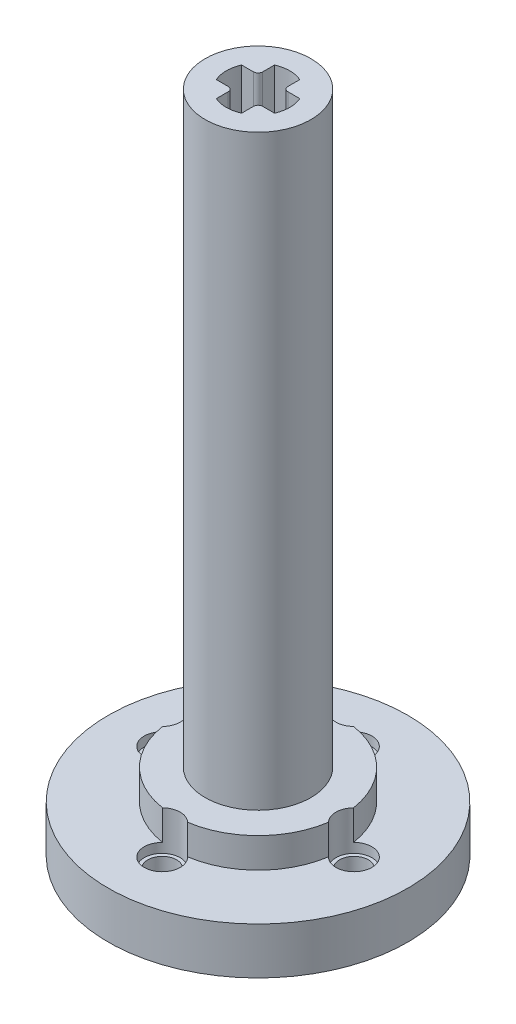
from build123d import *

# Parameters (mm, degrees)
CUT_EXTRUDE1_REACH             = 60.152
SKETCH3_R                      = 1.5
CUT_EXTRUDE2_DEPTH             = 0.79375
CUT_EXTRUDE2_DIRECTION_2_REACH = 56.45
CUT_EXTRUDE3_REACH             = 56.45
SKETCH5_R                      = 1.2


with BuildPart() as part:
    # Sketch1 → Revolve1 (revolve)
    with BuildSketch(Plane.XY, mode=Mode.PRIVATE) as revolve1_sk:
        Polygon((0, 0), (0, 55.4), (4.41, 55.4), (4.41, 6.4), (7, 6.4), (7, 3.9), (12.5, 3.9), (12.5, 0), align=None)
    revolve(revolve1_sk.sketch.rotate(Axis((0, 0, 0), (0, 1, 0)), 90), axis=Axis((0, 0, 0), (0, 1, 0)))

    # Sketch2 → Cut-Extrude1 (cut, up to next)
    with BuildSketch(Plane(origin=(0, 55.4, 0), x_dir=(1, 0, 0), z_dir=(0, 1, 0)), mode=Mode.PRIVATE) as cut_extrude1_sk1:
        with BuildLine():
            Line((-0.935, -1.435), (-0.935, -2.35))
            ThreePointArc((-0.935, -2.35), (0, -2.529174767), (0.935, -2.35))
            Line((0.935, -2.35), (0.935, -1.435))
            ThreePointArc((0.935, -1.435), (1.081446609, -1.081446609), (1.435, -0.935))
            Line((1.435, -0.935), (2.35, -0.935))
            ThreePointArc((2.35, -0.935), (2.529174767, 0), (2.35, 0.935))
            Line((2.35, 0.935), (1.435, 0.935))
            ThreePointArc((1.435, 0.935), (1.081446609, 1.081446609), (0.935, 1.435))
            Line((0.935, 1.435), (0.935, 2.35))
            ThreePointArc((0.935, 2.35), (0, 2.529174767), (-0.935, 2.35))
            Line((-0.935, 2.35), (-0.935, 1.435))
            ThreePointArc((-0.935, 1.435), (-1.081446609, 1.081446609), (-1.435, 0.935))
            Line((-1.435, 0.935), (-2.35, 0.935))
            ThreePointArc((-2.35, 0.935), (-2.529174767, 0), (-2.35, -0.935))
            Line((-2.35, -0.935), (-1.435, -0.935))
            ThreePointArc((-1.435, -0.935), (-1.081446609, -1.081446609), (-0.935, -1.435))
        make_face()
    cut_extrude1_tool1 = extrude(cut_extrude1_sk1.sketch, amount=-CUT_EXTRUDE1_REACH, mode=Mode.PRIVATE) & part.part
    # Sketch2 → Cut-Extrude1 (cut, up to next)
    with BuildSketch(Plane(origin=(0, 55.4, 0), x_dir=(1, 0, 0), z_dir=(0, 1, 0)), mode=Mode.PRIVATE) as cut_extrude1_sk2:
        with BuildLine():
            Line((1.055, 2.430041552), (1.055, 1.435))
            ThreePointArc((1.055, 1.435), (1.166299423, 1.166299423), (1.435, 1.055))
            Line((1.435, 1.055), (2.430041552, 1.055))
            ThreePointArc((2.430041552, 1.055), (2.649174767, 0), (2.430041552, -1.055))
            Line((2.430041552, -1.055), (1.435, -1.055))
            ThreePointArc((1.435, -1.055), (1.166299423, -1.166299423), (1.055, -1.435))
            Line((1.055, -1.435), (1.055, -2.430041552))
            ThreePointArc((1.055, -2.430041552), (0, -2.649174767), (-1.055, -2.430041552))
            Line((-1.055, -2.430041552), (-1.055, -1.435))
            ThreePointArc((-1.055, -1.435), (-1.166299423, -1.166299423), (-1.435, -1.055))
            Line((-1.435, -1.055), (-2.430041552, -1.055))
            ThreePointArc((-2.430041552, -1.055), (-2.649174767, 0), (-2.430041552, 1.055))
            Line((-2.430041552, 1.055), (-1.435, 1.055))
            ThreePointArc((-1.435, 1.055), (-1.166299423, 1.166299423), (-1.055, 1.435))
            Line((-1.055, 1.435), (-1.055, 2.430041552))
            ThreePointArc((-1.055, 2.430041552), (0, 2.649174767), (1.055, 2.430041552))
        make_face()
    cut_extrude1_tool2 = extrude(cut_extrude1_sk2.sketch, amount=-CUT_EXTRUDE1_REACH, mode=Mode.PRIVATE) & part.part
    add(cut_extrude1_tool1.solids().sort_by_distance((0, 55.4, 0))[0], mode=Mode.SUBTRACT)
    add(cut_extrude1_tool2.solids().sort_by_distance((0, 55.4, 0))[0], mode=Mode.SUBTRACT)

    # Sketch3 → Cut-Extrude2 (cut)
    with BuildSketch(Plane(origin=(0, 3.9, 0), x_dir=(1, 0, 0), z_dir=(0, 1, 0))):
        with Locations(Location((0, 8, 0), (0, 0, 314.048625674))):
            Circle(SKETCH3_R)
        with Locations(Location((0, -8, 0), (0, 0, 90))):
            Circle(SKETCH3_R)
        with Locations(Location((-8, 0, 0), (0, 0, 44.048625674))):
            Circle(SKETCH3_R)
        with Locations(Location((8, 0, 0), (0, 0, 90))):
            Circle(SKETCH3_R)
    extrude(amount=-CUT_EXTRUDE2_DEPTH, mode=Mode.SUBTRACT)

    # Cut-Extrude2 direction 2: up to this face of the body (flat: up to its plane)
    cut_extrude2_direction_2_end = Plane(part.part.faces().sort_by_distance((0, 6.4, 4.607989899))[0])
    # Sketch3 → Cut-Extrude2 direction 2 (cut, up to the picked face)
    with BuildSketch(Plane(origin=(0, 3.9, 0), x_dir=(1, 0, 0), z_dir=(0, 1, 0)), mode=Mode.PRIVATE) as cut_extrude2_direction_2_sk1:
        with Locations(Location((0, 8, 0), (0, 0, 314.048625674))):
            Circle(SKETCH3_R)
    cut_extrude2_direction_2_tool1 = split(extrude(cut_extrude2_direction_2_sk1.sketch, amount=CUT_EXTRUDE2_DIRECTION_2_REACH, mode=Mode.PRIVATE), bisect_by=cut_extrude2_direction_2_end, keep=Keep.BOTH, mode=Mode.PRIVATE)
    # Sketch3 → Cut-Extrude2 direction 2 (cut, up to the picked face)
    with BuildSketch(Plane(origin=(0, 3.9, 0), x_dir=(1, 0, 0), z_dir=(0, 1, 0)), mode=Mode.PRIVATE) as cut_extrude2_direction_2_sk2:
        with Locations(Location((0, -8, 0), (0, 0, 90))):
            Circle(SKETCH3_R)
    cut_extrude2_direction_2_tool2 = split(extrude(cut_extrude2_direction_2_sk2.sketch, amount=CUT_EXTRUDE2_DIRECTION_2_REACH, mode=Mode.PRIVATE), bisect_by=cut_extrude2_direction_2_end, keep=Keep.BOTH, mode=Mode.PRIVATE)
    # Sketch3 → Cut-Extrude2 direction 2 (cut, up to the picked face)
    with BuildSketch(Plane(origin=(0, 3.9, 0), x_dir=(1, 0, 0), z_dir=(0, 1, 0)), mode=Mode.PRIVATE) as cut_extrude2_direction_2_sk3:
        with Locations(Location((-8, 0, 0), (0, 0, 44.048625674))):
            Circle(SKETCH3_R)
    cut_extrude2_direction_2_tool3 = split(extrude(cut_extrude2_direction_2_sk3.sketch, amount=CUT_EXTRUDE2_DIRECTION_2_REACH, mode=Mode.PRIVATE), bisect_by=cut_extrude2_direction_2_end, keep=Keep.BOTH, mode=Mode.PRIVATE)
    # Sketch3 → Cut-Extrude2 direction 2 (cut, up to the picked face)
    with BuildSketch(Plane(origin=(0, 3.9, 0), x_dir=(1, 0, 0), z_dir=(0, 1, 0)), mode=Mode.PRIVATE) as cut_extrude2_direction_2_sk4:
        with Locations(Location((8, 0, 0), (0, 0, 90))):
            Circle(SKETCH3_R)
    cut_extrude2_direction_2_tool4 = split(extrude(cut_extrude2_direction_2_sk4.sketch, amount=CUT_EXTRUDE2_DIRECTION_2_REACH, mode=Mode.PRIVATE), bisect_by=cut_extrude2_direction_2_end, keep=Keep.BOTH, mode=Mode.PRIVATE)
    add(cut_extrude2_direction_2_tool1.solids().sort_by(Axis((0, 3.9, -8), (0, 1, 0)))[0], mode=Mode.SUBTRACT)
    add(cut_extrude2_direction_2_tool2.solids().sort_by(Axis((0, 3.9, 8), (0, 1, 0)))[0], mode=Mode.SUBTRACT)
    add(cut_extrude2_direction_2_tool3.solids().sort_by(Axis((-8, 3.9, 0), (0, 1, 0)))[0], mode=Mode.SUBTRACT)
    add(cut_extrude2_direction_2_tool4.solids().sort_by(Axis((8, 3.9, 0), (0, 1, 0)))[0], mode=Mode.SUBTRACT)

    # Sketch5 → Cut-Extrude3 (cut, up to next)
    with BuildSketch(Plane(origin=(0, 3.9, 0), x_dir=(1, 0, 0), z_dir=(0, 1, 0)), mode=Mode.PRIVATE) as cut_extrude3_sk1:
        with Locations(Location((8, 0, 0), (0, 0, 90))):
            Circle(SKETCH5_R)
    cut_extrude3_tool1 = extrude(cut_extrude3_sk1.sketch, amount=-CUT_EXTRUDE3_REACH, mode=Mode.PRIVATE) & part.part
    # Sketch5 → Cut-Extrude3 (cut, up to next)
    with BuildSketch(Plane(origin=(0, 3.9, 0), x_dir=(1, 0, 0), z_dir=(0, 1, 0)), mode=Mode.PRIVATE) as cut_extrude3_sk2:
        with Locations(Location((0, 8, 0), (0, 0, 270))):
            Circle(SKETCH5_R)
    cut_extrude3_tool2 = extrude(cut_extrude3_sk2.sketch, amount=-CUT_EXTRUDE3_REACH, mode=Mode.PRIVATE) & part.part
    # Sketch5 → Cut-Extrude3 (cut, up to next)
    with BuildSketch(Plane(origin=(0, 3.9, 0), x_dir=(1, 0, 0), z_dir=(0, 1, 0)), mode=Mode.PRIVATE) as cut_extrude3_sk3:
        with Locations(Location((-8, 0, 0), (0, 0, 270))):
            Circle(SKETCH5_R)
    cut_extrude3_tool3 = extrude(cut_extrude3_sk3.sketch, amount=-CUT_EXTRUDE3_REACH, mode=Mode.PRIVATE) & part.part
    # Sketch5 → Cut-Extrude3 (cut, up to next)
    with BuildSketch(Plane(origin=(0, 3.9, 0), x_dir=(1, 0, 0), z_dir=(0, 1, 0)), mode=Mode.PRIVATE) as cut_extrude3_sk4:
        with Locations(Location((0, -8, 0), (0, 0, 90))):
            Circle(SKETCH5_R)
    cut_extrude3_tool4 = extrude(cut_extrude3_sk4.sketch, amount=-CUT_EXTRUDE3_REACH, mode=Mode.PRIVATE) & part.part
    add(cut_extrude3_tool1.solids().sort_by_distance((8, 3.9, 0))[0], mode=Mode.SUBTRACT)
    add(cut_extrude3_tool2.solids().sort_by_distance((0, 3.9, -8))[0], mode=Mode.SUBTRACT)
    add(cut_extrude3_tool3.solids().sort_by_distance((-8, 3.9, 0))[0], mode=Mode.SUBTRACT)
    add(cut_extrude3_tool4.solids().sort_by_distance((0, 3.9, 8))[0], mode=Mode.SUBTRACT)


solid = part.part
